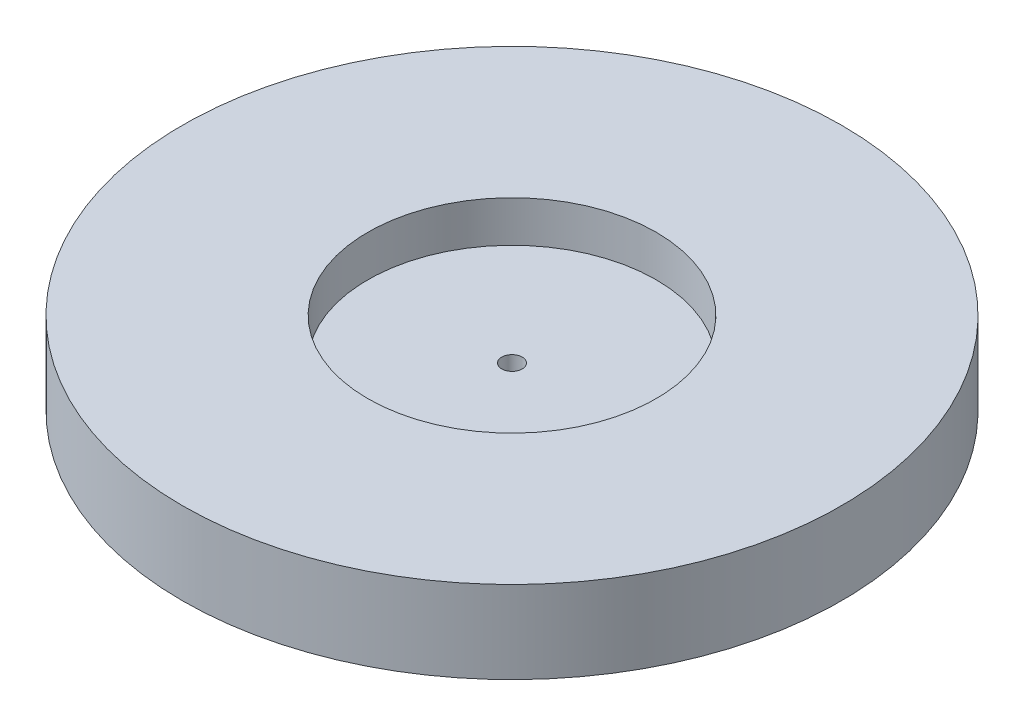
from build123d import *

# Parameters (mm, degrees)
SKETCH1_R           = 101.6
SKETCH1_R_2         = 3.175
BOSS_EXTRUDE1_DEPTH = 25.4
SKETCH3_R           = 44.45
CUT_EXTRUDE1_DEPTH  = 12.7


with BuildPart() as part:
    # Sketch1 → Boss-Extrude1 (new body)
    with BuildSketch(Plane(origin=(0, 0, 0), x_dir=(1, 0, 0), z_dir=(0, 1, 0))):
        with Locations(Location((0, 0, 0), (0, 0, 270))):
            Circle(SKETCH1_R)
        with Locations(Location((0, 0, 0), (0, 0, 270))):
            Circle(SKETCH1_R_2, mode=Mode.SUBTRACT)
    extrude(amount=BOSS_EXTRUDE1_DEPTH)

    # Sketch3 → Cut-Extrude1 (cut)
    with BuildSketch(Plane(origin=(0, 25.4, 0), x_dir=(1, 0, 0), z_dir=(0, 1, 0))):
        with Locations(Location((0, 0, 0), (0, 0, 270))):
            Circle(SKETCH3_R)
    extrude(amount=-CUT_EXTRUDE1_DEPTH, mode=Mode.SUBTRACT)


solid = part.part
